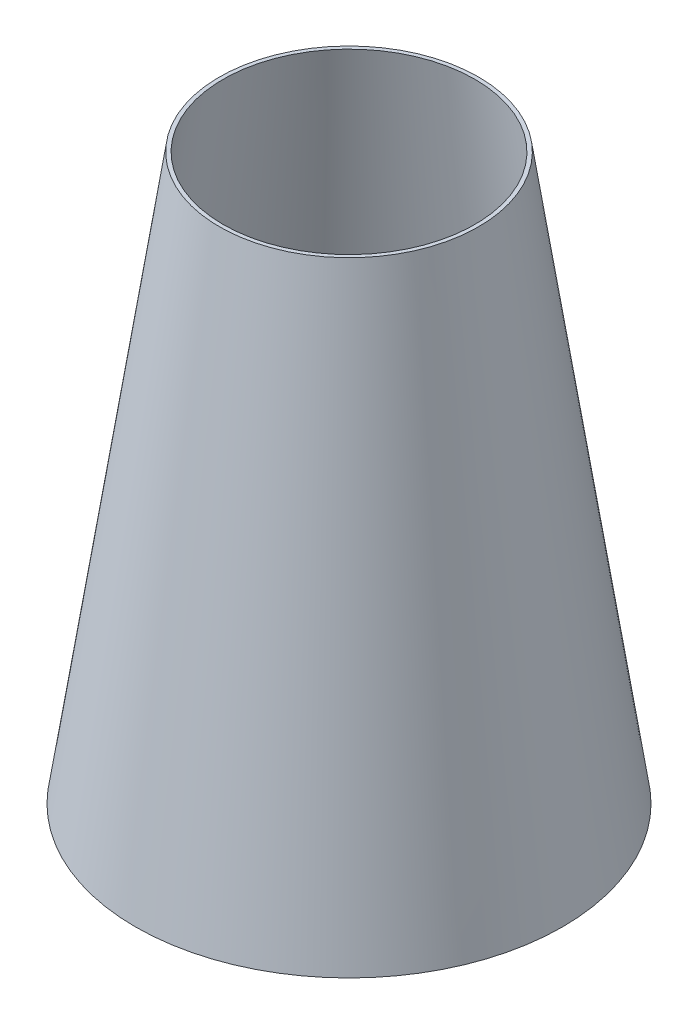
from build123d import *


with BuildPart() as part:
    # Sketch1 → Revolve1 (revolve)
    with BuildSketch(Plane.XY, mode=Mode.PRIVATE) as revolve1_sk:
        Polygon((-87.3125, -74.510550459), (-52.3875, 160.439449541), (-53.975, 160.439449541), (-88.9, -74.510550459), align=None)
    revolve(revolve1_sk.sketch.rotate(Axis((0, -74.510550459, 0), (0, 1, 0)), 270), axis=Axis((0, -74.510550459, 0), (0, 1, 0)))


solid = part.part
